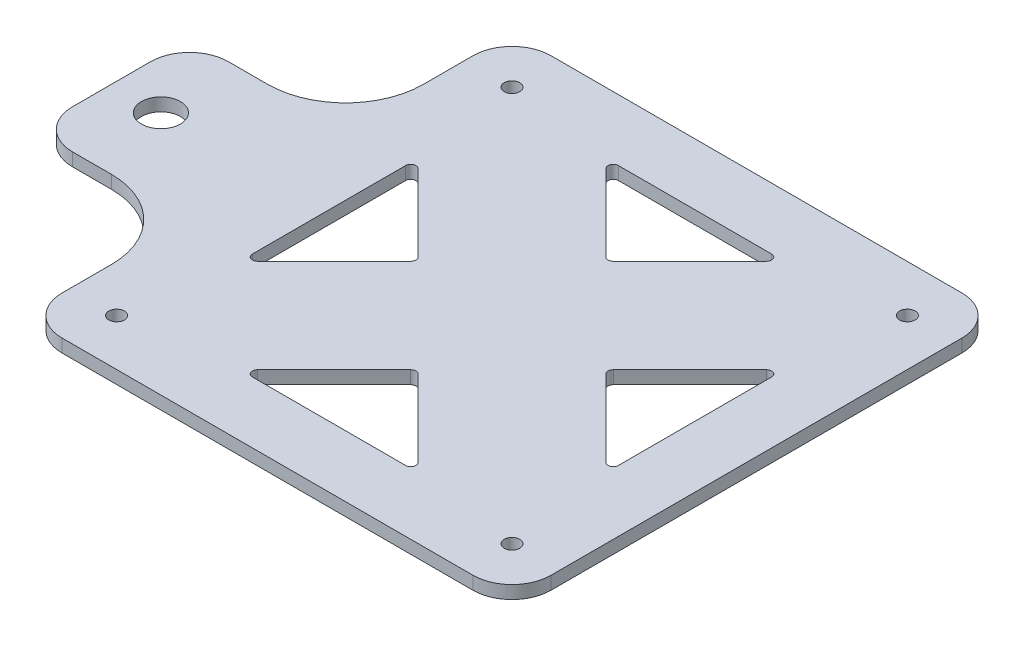
from build123d import *

# Parameters (mm, degrees)
SKETCH1_R           = 3
SKETCH1_R_2         = 7.5
BOSS_EXTRUDE1_DEPTH = 2.5
FILLET1_R           = 30
FILLET2_R           = 15


with BuildPart() as part:
    # Sketch1 → Boss-Extrude1 (new, symmetric)
    with BuildSketch(Plane(origin=(0, 0, 0), x_dir=(1, 0, 0), z_dir=(0, 1, 0))):
        with BuildLine():
            Line((-79, 94), (79, 94))
            ThreePointArc((79, 94), (89.606601718, 89.606601718), (94, 79))
            Line((94, 79), (94, -79))
            ThreePointArc((94, -79), (89.606601718, -89.606601718), (79, -94))
            Line((79, -94), (-79, -94))
            ThreePointArc((-79, -94), (-89.606601718, -89.606601718), (-94, -79))
            Line((-94, -79), (-94, -30))
            Line((-94, -30), (-154, -30))
            Line((-154, -30), (-154, 30))
            Line((-154, 30), (-94, 30))
            Line((-94, 30), (-94, 79))
            ThreePointArc((-94, 79), (-89.606601718, 89.606601718), (-79, 94))
        make_face()
        with Locations(Location((-76.013978978, 76.013978978, 0), (0, 0, 270))):
            Circle(SKETCH1_R, mode=Mode.SUBTRACT)
        with Locations(Location((76.013978978, 76.013978978, 0), (0, 0, 270))):
            Circle(SKETCH1_R, mode=Mode.SUBTRACT)
        with Locations(Location((76.013978978, -76.013978978, 0), (0, 0, 270))):
            Circle(SKETCH1_R, mode=Mode.SUBTRACT)
        with Locations(Location((-76.013978978, -76.013978978, 0), (0, 0, 270))):
            Circle(SKETCH1_R, mode=Mode.SUBTRACT)
        with Locations(Location((-135, 0, 0), (0, 0, 270))):
            Circle(SKETCH1_R_2, mode=Mode.SUBTRACT)
        with BuildLine():
            Line((29.446798758, -70.384478511), (-29.446798758, -70.384478511))
            ThreePointArc((-29.446798758, -70.384478511), (-31.294557823, -69.149845375), (-30.86101232, -66.970264948))
            Line((-30.86101232, -66.970264948), (-1.414213562, -37.52346619))
            ThreePointArc((-1.414213562, -37.52346619), (0, -36.937679753), (1.414213562, -37.52346619))
            Line((1.414213562, -37.52346619), (30.86101232, -66.970264948))
            ThreePointArc((30.86101232, -66.970264948), (31.294557823, -69.149845375), (29.446798758, -70.384478511))
        make_face(mode=Mode.SUBTRACT)
        with BuildLine():
            Line((-70.384478511, -29.446798758), (-70.384478511, 29.446798758))
            ThreePointArc((-70.384478511, 29.446798758), (-69.149845375, 31.294557823), (-66.970264948, 30.86101232))
            Line((-66.970264948, 30.86101232), (-37.52346619, 1.414213562))
            ThreePointArc((-37.52346619, 1.414213562), (-36.937679753, 0), (-37.52346619, -1.414213562))
            Line((-37.52346619, -1.414213562), (-66.970264948, -30.86101232))
            ThreePointArc((-66.970264948, -30.86101232), (-69.149845375, -31.294557823), (-70.384478511, -29.446798758))
        make_face(mode=Mode.SUBTRACT)
        with BuildLine():
            Line((-29.446798758, 70.384478511), (29.446798758, 70.384478511))
            ThreePointArc((29.446798758, 70.384478511), (31.294557823, 69.149845375), (30.86101232, 66.970264948))
            Line((30.86101232, 66.970264948), (1.414213562, 37.52346619))
            ThreePointArc((1.414213562, 37.52346619), (0, 36.937679753), (-1.414213562, 37.52346619))
            Line((-1.414213562, 37.52346619), (-30.86101232, 66.970264948))
            ThreePointArc((-30.86101232, 66.970264948), (-31.294557823, 69.149845375), (-29.446798758, 70.384478511))
        make_face(mode=Mode.SUBTRACT)
        with BuildLine():
            Line((70.384478511, 29.446798758), (70.384478511, -29.446798758))
            ThreePointArc((70.384478511, -29.446798758), (69.149845375, -31.294557823), (66.970264948, -30.86101232))
            Line((66.970264948, -30.86101232), (37.52346619, -1.414213562))
            ThreePointArc((37.52346619, -1.414213562), (36.937679753, 0), (37.52346619, 1.414213562))
            Line((37.52346619, 1.414213562), (66.970264948, 30.86101232))
            ThreePointArc((66.970264948, 30.86101232), (69.149845375, 31.294557823), (70.384478511, 29.446798758))
        make_face(mode=Mode.SUBTRACT)
    extrude(amount=BOSS_EXTRUDE1_DEPTH, both=True)

    # Fillet1
    fillet1_edges = [part.edges().sort_by_distance(p)[0] for p in [
        (-94, 0, 30),
        (-94, 0, -30),
    ]]
    fillet(fillet1_edges, radius=FILLET1_R)

    # Fillet2
    fillet2_edges = [part.edges().sort_by_distance(p)[0] for p in [
        (-154, 0, 30),
        (-154, 0, -30),
    ]]
    fillet(fillet2_edges, radius=FILLET2_R)


solid = part.part
